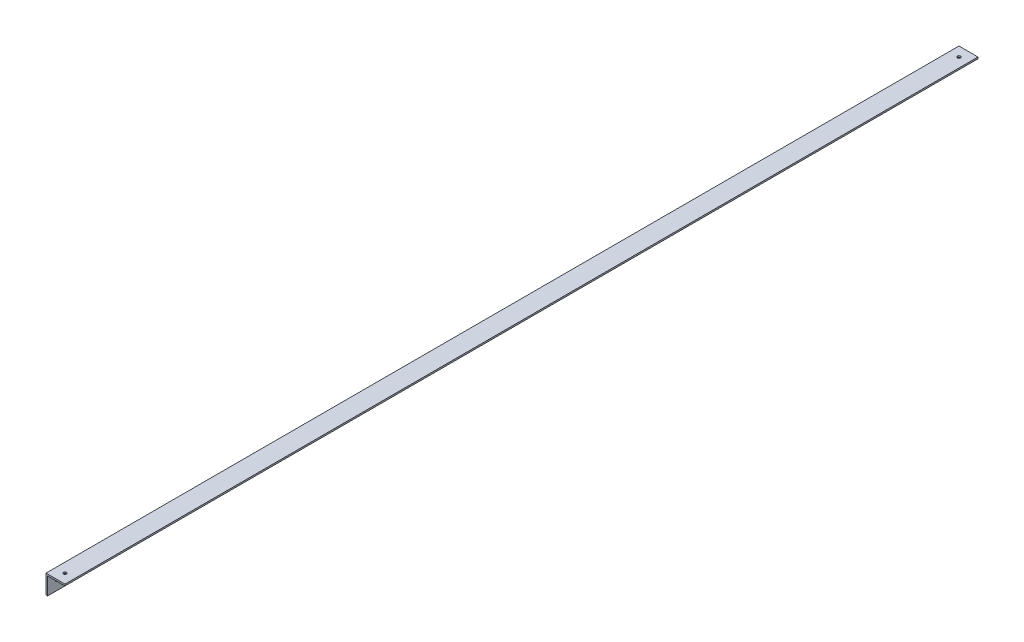
from build123d import *

# Parameters (mm, degrees)
BOSS_EXTRUDE1_DEPTH = 914.4
SKETCH2_R           = 1.5875
CUT_EXTRUDE2_DEPTH  = 2.794
SKETCH4_R           = 1.5875
SKETCH4_R_2         = 3.175
CUT_EXTRUDE3_DEPTH  = 8.89
SKETCH10_W          = 19.05
SKETCH10_H          = 914.4
CUT_EXTRUDE4_DEPTH  = 915.79678891
CUT_EXTRUDE5_REACH  = 917.392
SKETCH11_R          = 3.175


with BuildPart() as part:
    # Sketch1 → Boss-Extrude1 (new body)
    with BuildSketch(Plane.XY):
        Polygon((0, 0), (0, 19.05), (1.5875, 19.05), (1.5875, 1.5875), (19.05, 1.5875), (19.05, 0), align=None)
    boss_extrude1 = extrude(amount=-BOSS_EXTRUDE1_DEPTH)

    # Sketch2 → Cut-Extrude2 (cut)
    with BuildSketch(Plane(origin=(0, 1.5875, 0), x_dir=(1, 0, 0), z_dir=(0, 1, 0))):
        with Locations((9.525, 9.525)):
            Circle(SKETCH2_R)
        with Locations((9.525, 904.875)):
            Circle(SKETCH2_R)
    cut_extrude2 = extrude(amount=-CUT_EXTRUDE2_DEPTH, mode=Mode.SUBTRACT)

    # Sketch4 → Cut-Extrude3 (cut)
    with BuildSketch(Plane(origin=(1.5875, 0, 0), x_dir=(0, 0, -1), z_dir=(1, 0, 0))):
        with Locations((9.525, 9.525)):
            Circle(SKETCH4_R)
        with Locations((904.875, 9.525)):
            Circle(SKETCH4_R)
        with Locations((254, 9.525)):
            Circle(SKETCH4_R_2)
        with Locations((285.75, 9.525)):
            Circle(SKETCH4_R_2)
        with Locations((317.5, 9.525)):
            Circle(SKETCH4_R_2)
        with Locations((349.25, 9.525)):
            Circle(SKETCH4_R_2)
        with Locations((469.9, 9.525)):
            Circle(SKETCH4_R_2)
        with Locations((406.4, 9.525)):
            Circle(SKETCH4_R_2)
        with Locations((438.15, 9.525)):
            Circle(SKETCH4_R_2)
        with Locations((374.65, 9.525)):
            Circle(SKETCH4_R_2)
    cut_extrude3 = extrude(amount=-CUT_EXTRUDE3_DEPTH, mode=Mode.SUBTRACT)

    # Mirror1: Boss-Extrude1, Cut-Extrude2, Cut-Extrude3 across plane
    add(boss_extrude1.mirror(Plane(origin=(0, 19.05, -914.4), x_dir=(0, 0, 1), z_dir=(0, 1, 0))))
    add(cut_extrude2.mirror(Plane(origin=(0, 19.05, -914.4), x_dir=(0, 0, 1), z_dir=(0, 1, 0))), mode=Mode.SUBTRACT)
    add(cut_extrude3.mirror(Plane(origin=(0, 19.05, -914.4), x_dir=(0, 0, 1), z_dir=(0, 1, 0))), mode=Mode.SUBTRACT)

    # Sketch10 → Cut-Extrude4 (cut, through all)
    with BuildSketch(Plane(origin=(0, 19.05, 0), x_dir=(-1, 0, 0), z_dir=(0, -1, 0))):
        with Locations((-9.525, 457.2)):
            Rectangle(SKETCH10_W, SKETCH10_H)
    extrude(amount=CUT_EXTRUDE4_DEPTH, mode=Mode.SUBTRACT)

    # Sketch11 → Cut-Extrude5 (cut, up to next)
    with BuildSketch(Plane.ZY, mode=Mode.PRIVATE) as cut_extrude5_sk1:
        with Locations((-495.3, 28.575)):
            Circle(SKETCH11_R)
    cut_extrude5_tool1 = extrude(cut_extrude5_sk1.sketch, amount=-CUT_EXTRUDE5_REACH, mode=Mode.PRIVATE) & part.part
    # Sketch11 → Cut-Extrude5 (cut, up to next)
    with BuildSketch(Plane.ZY, mode=Mode.PRIVATE) as cut_extrude5_sk2:
        with Locations((-228.6, 28.575)):
            Circle(SKETCH11_R)
    cut_extrude5_tool2 = extrude(cut_extrude5_sk2.sketch, amount=-CUT_EXTRUDE5_REACH, mode=Mode.PRIVATE) & part.part
    add(cut_extrude5_tool1.solids().sort_by_distance((0, 28.575, -495.3))[0], mode=Mode.SUBTRACT)
    add(cut_extrude5_tool2.solids().sort_by_distance((0, 28.575, -228.6))[0], mode=Mode.SUBTRACT)


solid = part.part
